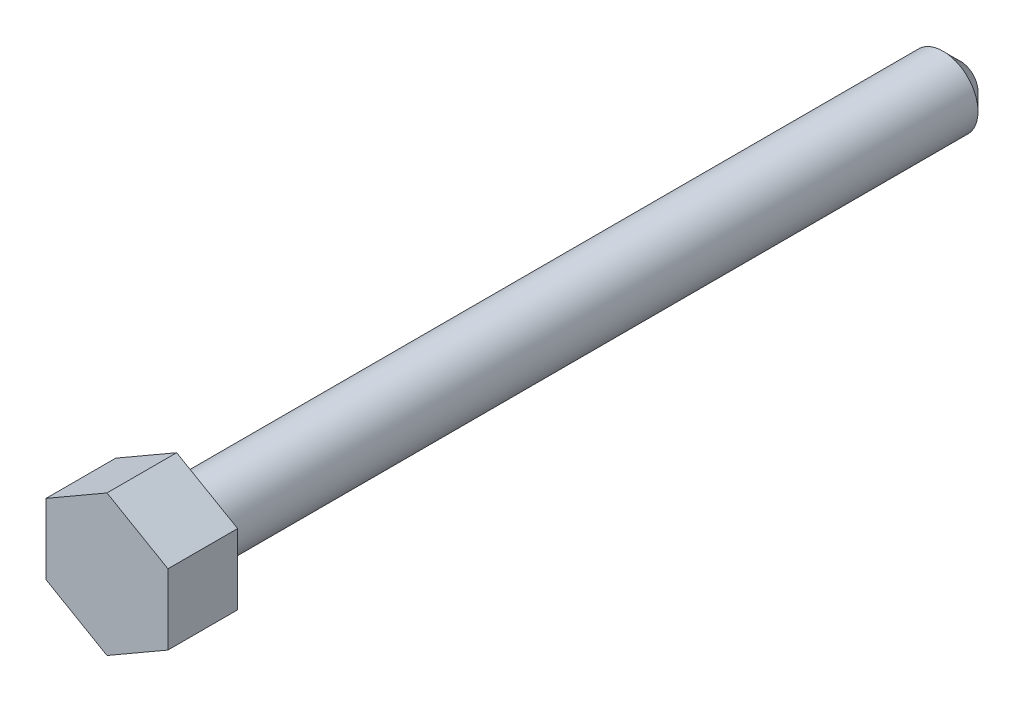
from build123d import *

# Parameters (mm, degrees)
SKETCH1_R         = 2
EXTRUDE_311_DEPTH = 45
EXTRUDE_445_DEPTH = 4
CHAMFER1_SIZE     = 1


with BuildPart() as part:
    # Sketch1 → Extrude 311 (new body)
    with BuildSketch(Plane.XY):
        with Locations(Location((0, 0, 0), (0, 0, 180))):
            Circle(SKETCH1_R)
    extrude(amount=EXTRUDE_311_DEPTH)

    # Sketch2 → Extrude 445 (add)
    with BuildSketch(Plane.XY.offset(45)):
        Polygon((0, 4.041451884), (-3.5, 2.020725942), (-3.5, -2.020725942), (0, -4.041451884), (3.5, -2.020725942), (3.5, 2.020725942), align=None)
    extrude(amount=EXTRUDE_445_DEPTH)

    # Chamfer1
    chamfer1_edges = [part.edges().sort_by_distance(p)[0] for p in [
        (2, 0, 0),
    ]]
    chamfer(chamfer1_edges, length=CHAMFER1_SIZE)


solid = part.part
